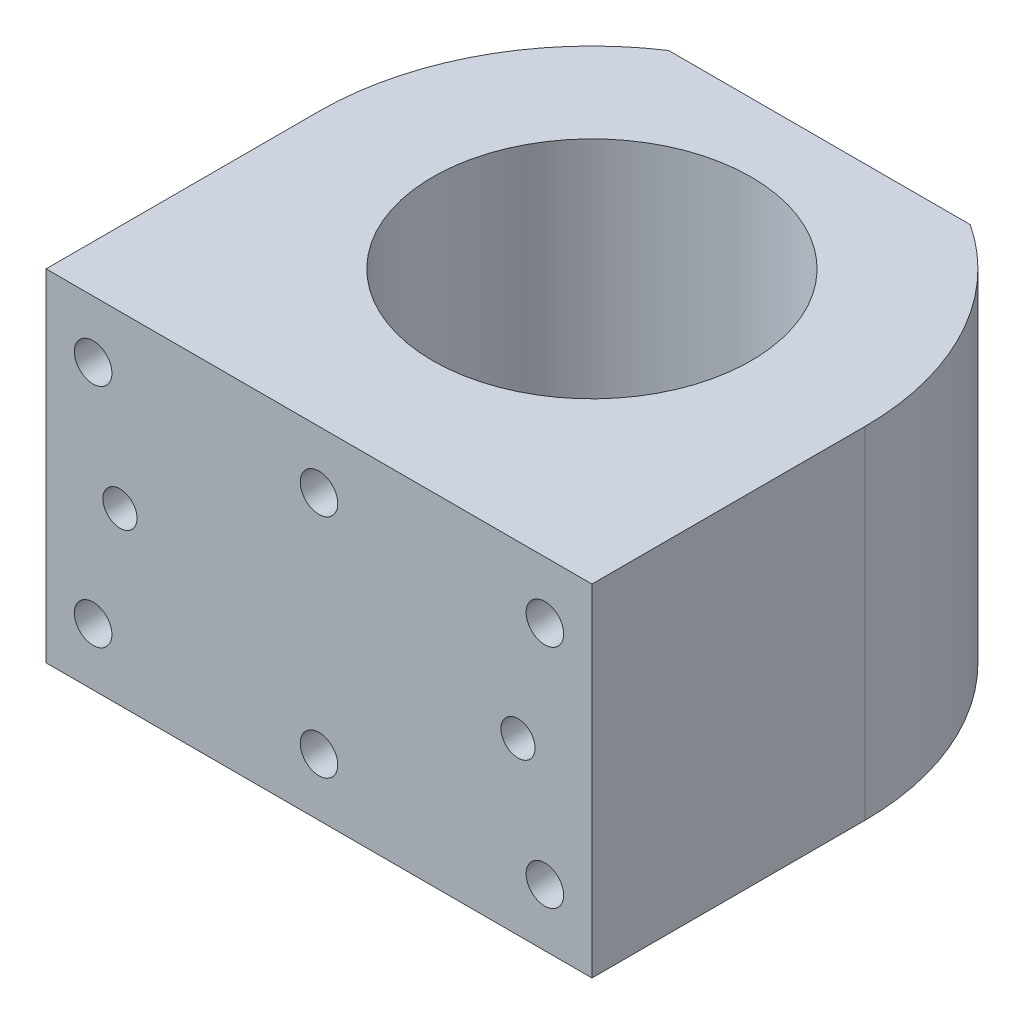
from build123d import *

# Parameters (mm, degrees)
BOSS_EXTRUDE1_DEPTH       = 15
M4X0_7_TAPPED_HOLE1_D     = 3.3
M4X0_7_TAPPED_HOLE1_DEPTH = 8
M4X0_7_TAPPED_HOLE1_TIP   = 0.991420021
F_3_0MM_DOWEL_HOLE1_D     = 3
F_3_0MM_DOWEL_HOLE1_DEPTH = 4.85
F_3_0MM_DOWEL_HOLE1_TIP   = 0.901290929
SKETCH6_R                 = 14
CUT_EXTRUDE1_DEPTH        = 30


with BuildPart() as part:
    # Sketch1 → Boss-Extrude1 (new, symmetric)
    with BuildSketch(Plane(origin=(0, 0, 0), x_dir=(1, 0, 0), z_dir=(0, 1, 0))):
        with BuildLine():
            Line((13.266499161, 20), (-13.266499161, 20))
            ThreePointArc((-13.266499161, 20), (-21.147056295, 11.349097324), (-24, 0))
            Line((-24, 0), (-24, -24))
            Line((-24, -24), (24, -24))
            Line((24, -24), (24, 0))
            ThreePointArc((24, 0), (21.147056295, 11.349097324), (13.266499161, 20))
        make_face()
    extrude(amount=BOSS_EXTRUDE1_DEPTH, both=True)

    # M4x0.7 Tapped Hole1
    with Locations(Plane.XY.offset(24)):
        with Locations((-19.86, 9.95), (0, 9.95), (19.86, 9.95), (19.86, -9.95), (0, -9.95), (-19.86, -9.95)):
            Hole(M4X0_7_TAPPED_HOLE1_D / 2, depth=M4X0_7_TAPPED_HOLE1_DEPTH)
            with Locations((0, 0, -(M4X0_7_TAPPED_HOLE1_DEPTH + M4X0_7_TAPPED_HOLE1_TIP / 2))):  # 118° drill point
                Cone(0, M4X0_7_TAPPED_HOLE1_D / 2, M4X0_7_TAPPED_HOLE1_TIP, mode=Mode.SUBTRACT)

    # Ø3.0mm Dowel Hole1
    with Locations(Plane.XY.offset(24)):
        with Locations((-17.5, 0), (17.5, 0)):
            Hole(F_3_0MM_DOWEL_HOLE1_D / 2, depth=F_3_0MM_DOWEL_HOLE1_DEPTH)
            with Locations((0, 0, -(F_3_0MM_DOWEL_HOLE1_DEPTH + F_3_0MM_DOWEL_HOLE1_TIP / 2))):  # 118° drill point
                Cone(0, F_3_0MM_DOWEL_HOLE1_D / 2, F_3_0MM_DOWEL_HOLE1_TIP, mode=Mode.SUBTRACT)

    # Sketch6 → Cut-Extrude1 (cut)
    with BuildSketch(Plane.XZ.offset(15)):
        Circle(SKETCH6_R)
    extrude(amount=-CUT_EXTRUDE1_DEPTH, mode=Mode.SUBTRACT)


solid = part.part
